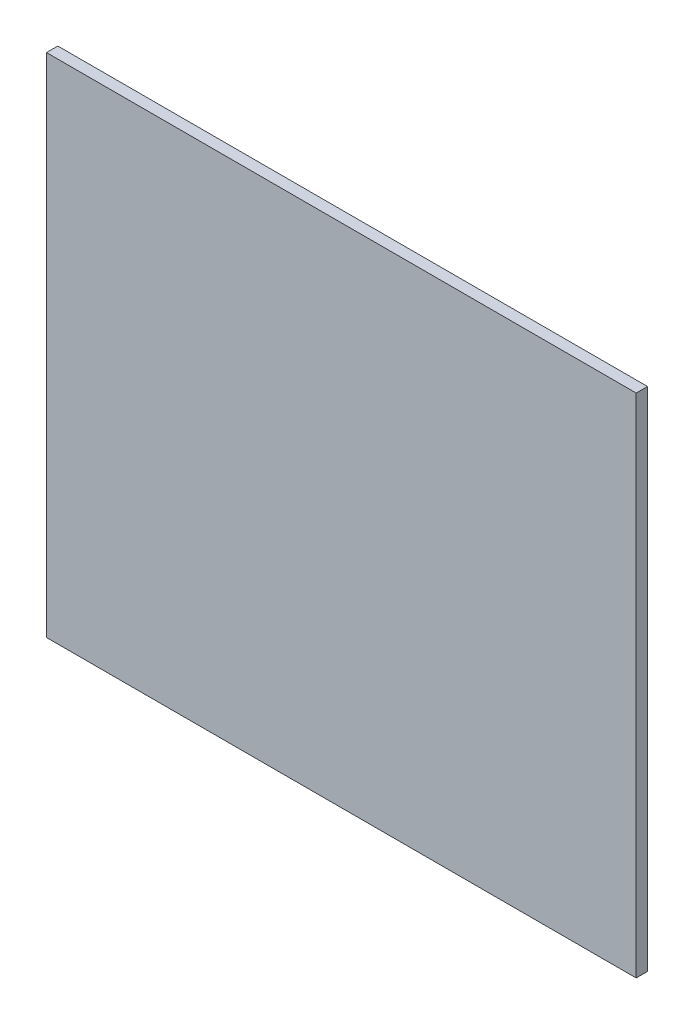
from build123d import *

# Parameters (mm, degrees)
ESBO_O1_W                = 78
ESBO_O1_H                = 67
RESSALTO_EXTRUS_O1_DEPTH = 1.5


with BuildPart() as part:
    # Esboço1 → Ressalto-extrusão1 (new body)
    with BuildSketch(Plane.XY):
        Rectangle(ESBO_O1_W, ESBO_O1_H)
    extrude(amount=RESSALTO_EXTRUS_O1_DEPTH)


solid = part.part
